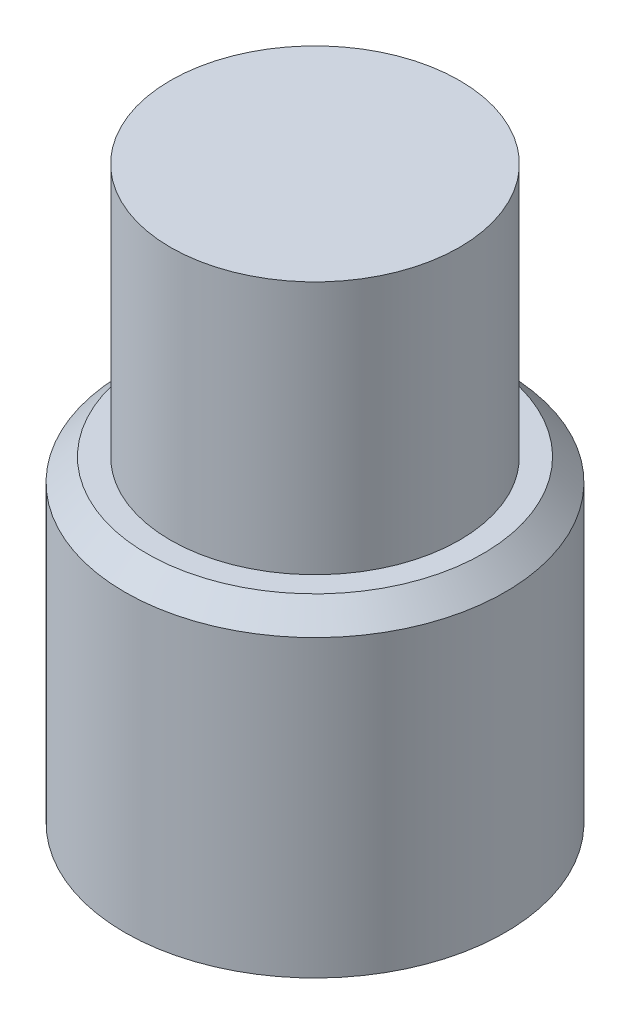
from build123d import *

# Parameters (mm, degrees)
SKETCH1_R           = 2.28
BOSS_EXTRUDE1_DEPTH = 9
SKETCH2_R           = 3
BOSS_EXTRUDE2_DEPTH = 5
CHAMFER1_SIZE       = 0.35


with BuildPart() as part:
    # Sketch1 → Boss-Extrude1 (new body)
    with BuildSketch(Plane(origin=(0, 0, 0), x_dir=(1, 0, 0), z_dir=(0, 1, 0))):
        with Locations(Location((0, 0, 0), (0, 0, 270))):
            Circle(SKETCH1_R)
    extrude(amount=BOSS_EXTRUDE1_DEPTH)

    # Sketch2 → Boss-Extrude2 (add)
    with BuildSketch(Plane(origin=(0, 0, 0), x_dir=(-1, 0, 0), z_dir=(0, -1, 0))):
        with Locations(Location((0, 0, 0), (0, 0, 90))):
            Circle(SKETCH2_R)
    extrude(amount=-BOSS_EXTRUDE2_DEPTH)

    # Chamfer1
    chamfer1_edges = [part.edges().sort_by_distance(p)[0] for p in [
        (0, 5, 3),
    ]]
    chamfer(chamfer1_edges, length=CHAMFER1_SIZE)


solid = part.part
